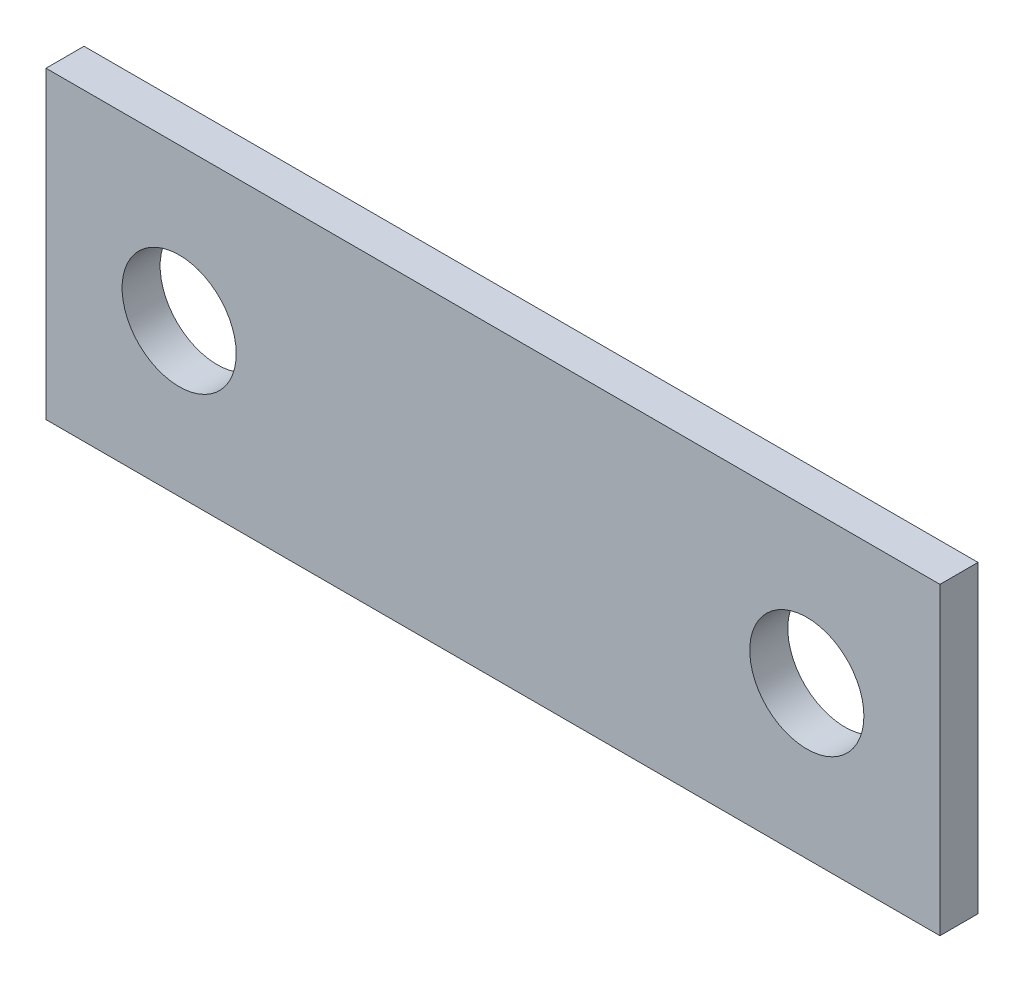
from build123d import *

# Parameters (mm, degrees)
SKETCH1_W           = 74.6125
SKETCH1_H           = 25.4
SKETCH1_R           = 4.7625
BOSS_EXTRUDE1_DEPTH = 3.175


with BuildPart() as part:
    # Sketch1 → Boss-Extrude1 (new body)
    with BuildSketch(Plane.XY):
        Rectangle(SKETCH1_W, SKETCH1_H)
        with Locations((-26.19375, 0)):
            Circle(SKETCH1_R, mode=Mode.SUBTRACT)
        with Locations((26.19375, 0)):
            Circle(SKETCH1_R, mode=Mode.SUBTRACT)
    extrude(amount=BOSS_EXTRUDE1_DEPTH)


solid = part.part
